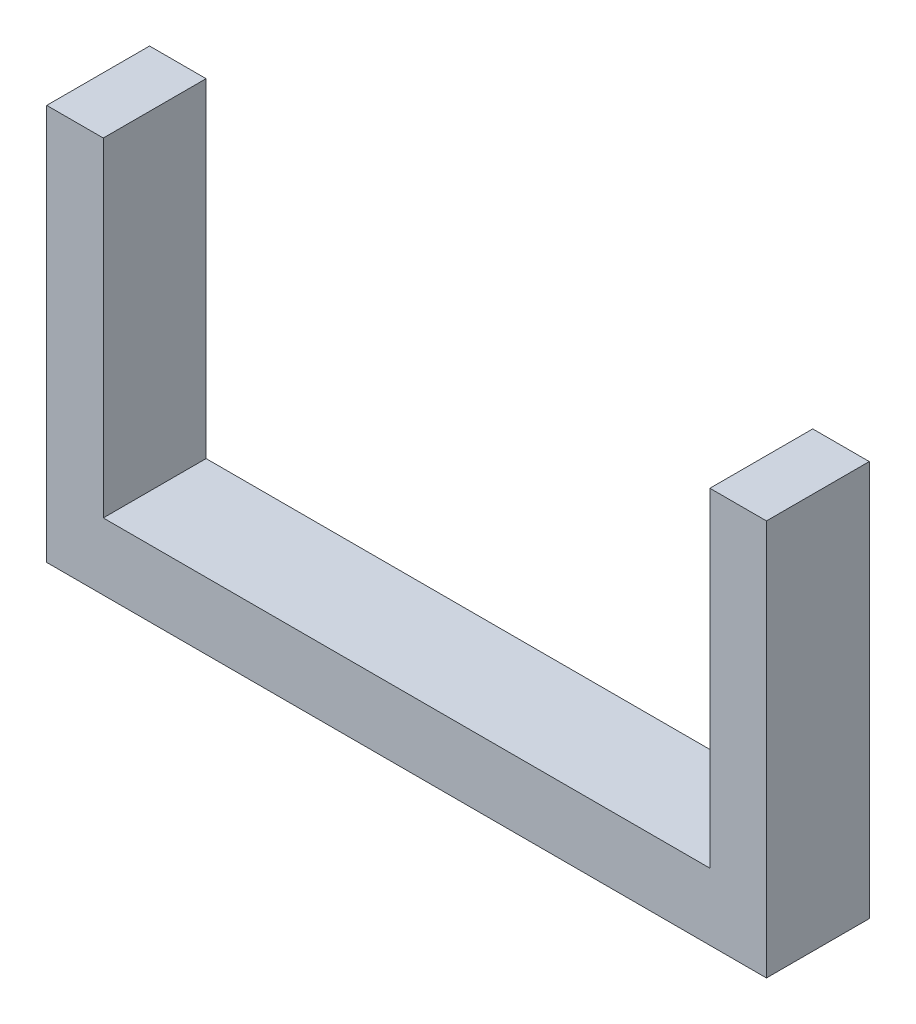
from build123d import *

# Parameters (mm, degrees)
SKETCH2_W                           = 28
SKETCH2_H                           = 18
SKETCH2_W_2                         = 23.6
SKETCH2_H_2                         = 12.8
SERVO_MOUNT_CRADLE_DEPTH            = 4
SKETCH3_W                           = 40
SKETCH3_H                           = 10
REAR_WALL_CLEARANCE_U_BRACKET_DEPTH = 18.117242769


with BuildPart() as part:
    # Sketch2 → Servo_mount_cradle (new body)
    with BuildSketch(Plane.XY):
        Rectangle(SKETCH2_W, SKETCH2_H)
        Rectangle(SKETCH2_W_2, SKETCH2_H_2, mode=Mode.SUBTRACT)
    extrude(amount=SERVO_MOUNT_CRADLE_DEPTH)

    # Sketch3 → Rear_wall_clearance_U_bracket (cut, through all)
    with BuildSketch(Plane.XY):
        with Locations((0, 11.4)):
            Rectangle(SKETCH3_W, SKETCH3_H)
    extrude(amount=REAR_WALL_CLEARANCE_U_BRACKET_DEPTH, mode=Mode.SUBTRACT)


solid = part.part
